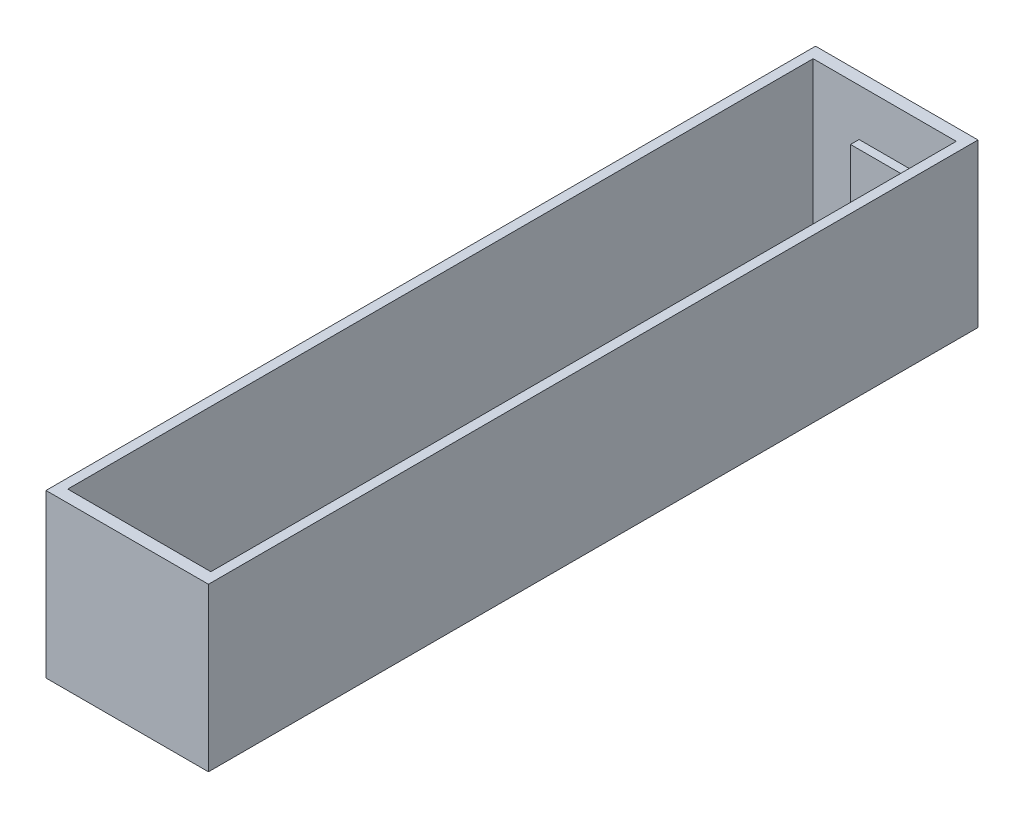
from build123d import *

# Parameters (mm, degrees)
SKETCH1_W           = 19
SKETCH1_H           = 90
BOSS_EXTRUDE2_DEPTH = 19
SKETCH2_W           = 16.74
SKETCH2_H           = 87.18
CUT_EXTRUDE1_DEPTH  = 17
SKETCH3_W           = 6
SKETCH3_H           = 6
BOSS_EXTRUDE4_DEPTH = 1
SKETCH5_W           = 6
SKETCH5_H           = 6
BOSS_EXTRUDE5_DEPTH = 1


with BuildPart() as part:
    # Sketch1 → Boss-Extrude2 (new body)
    with BuildSketch(Plane(origin=(0, 0, 0), x_dir=(1, 0, 0), z_dir=(0, 1, 0))):
        with Locations((-3.599862385, 31.801317605)):
            Rectangle(SKETCH1_W, SKETCH1_H)
    extrude(amount=BOSS_EXTRUDE2_DEPTH)

    # Sketch2 → Cut-Extrude1 (cut)
    with BuildSketch(Plane(origin=(0, 19, 0), x_dir=(1, 0, 0), z_dir=(0, 1, 0))):
        with Locations((-3.599862385, 31.801317605)):
            Rectangle(SKETCH2_W, SKETCH2_H)
    extrude(amount=-CUT_EXTRUDE1_DEPTH, mode=Mode.SUBTRACT)

    # Sketch3 → Boss-Extrude4 (add)
    with BuildSketch(Plane(origin=(0, 0, 11.788682395), x_dir=(-1, 0, 0), z_dir=(0, 0, -1))):
        with Locations((3.599862385, 10.5)):
            Rectangle(SKETCH3_W, SKETCH3_H)
    extrude(amount=BOSS_EXTRUDE4_DEPTH)

    # Sketch5 → Boss-Extrude5 (add)
    with BuildSketch(Plane.XY.offset(-75.391317605)):
        with Locations((-3.599862385, 10.5)):
            Rectangle(SKETCH5_W, SKETCH5_H)
    extrude(amount=BOSS_EXTRUDE5_DEPTH)


solid = part.part
